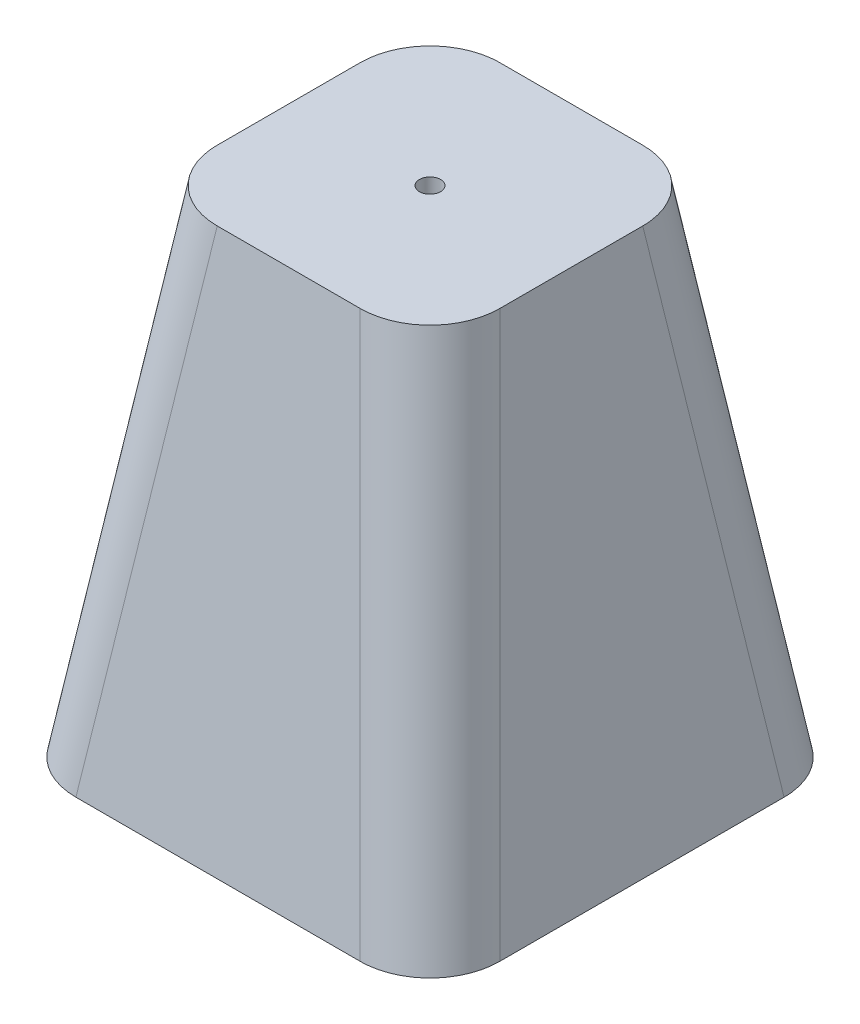
from build123d import *

# Parameters (mm, degrees)
SKETCH3_R          = 1.5
CUT_EXTRUDE1_DEPTH = 3
FILLET1_R          = 10


with BuildPart() as part:
    # Sketch2 → Loft1 section 0
    with BuildSketch(Plane(origin=(0, 70, 0), x_dir=(1, 0, 0), z_dir=(0, 1, 0))):
        with BuildLine():
            Line((-20, -20), (20, -20))
            Line((20, -20), (20, 20))
            Line((20, 20), (-20, 20))
            Line((-20, 20), (-20, -20))
        make_face()
    # Sketch1 → Loft1 section 1
    with BuildSketch(Plane(origin=(0, 0, 0), x_dir=(1, 0, 0), z_dir=(0, 1, 0))):
        with BuildLine():
            Line((-30, -30), (30, -30))
            Line((30, -30), (30, 30))
            Line((30, 30), (-30, 30))
            Line((-30, 30), (-30, -30))
        make_face()
    loft()

    # Sketch3 → Cut-Extrude1 (cut)
    with BuildSketch(Plane.XZ):
        with Locations(Location((0, 0, 0), (0, 0, 270))):
            Circle(SKETCH3_R)
    cut_extrude1 = extrude(amount=-CUT_EXTRUDE1_DEPTH, mode=Mode.SUBTRACT)

    # Mirror1: Cut-Extrude1 across plane
    add(cut_extrude1.mirror(Plane(origin=(0, 35, 0), x_dir=(0, 0, 1), z_dir=(0, -1, 0))), mode=Mode.SUBTRACT)

    # Fillet1
    fillet1_edges = [part.edges().sort_by_distance(p)[0] for p in [
        (-25, 35, -25),
        (25, 35, -25),
        (25, 35, 25),
        (-25, 35, 25),
    ]]
    fillet(fillet1_edges, radius=FILLET1_R)


solid = part.part
